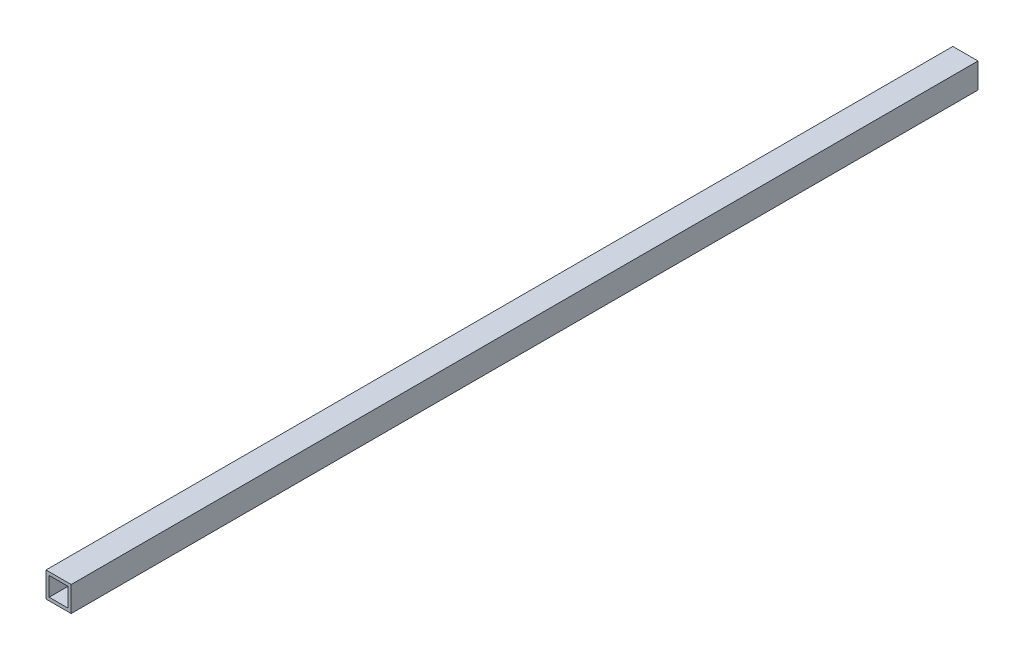
from build123d import *

# Parameters (mm, degrees)
BOSS_EXTRUDE1_DEPTH      = 457.2
BOSS_EXTRUDE1_DEPTH_BACK = 457.2
SKETCH3_W                = 25.4
SKETCH3_H                = 25.4
SKETCH3_W_2              = 19.05
SKETCH3_H_2              = 19.05


with BuildPart() as part:
    # Sketch3 → Boss-Extrude1 (new, two sides: drawn at the far end of the back side and taken through both)
    with BuildSketch(Plane.XY.offset(-BOSS_EXTRUDE1_DEPTH_BACK)):
        Rectangle(SKETCH3_W, SKETCH3_H)
        Rectangle(SKETCH3_W_2, SKETCH3_H_2, mode=Mode.SUBTRACT)
    extrude(amount=BOSS_EXTRUDE1_DEPTH + BOSS_EXTRUDE1_DEPTH_BACK)


solid = part.part
